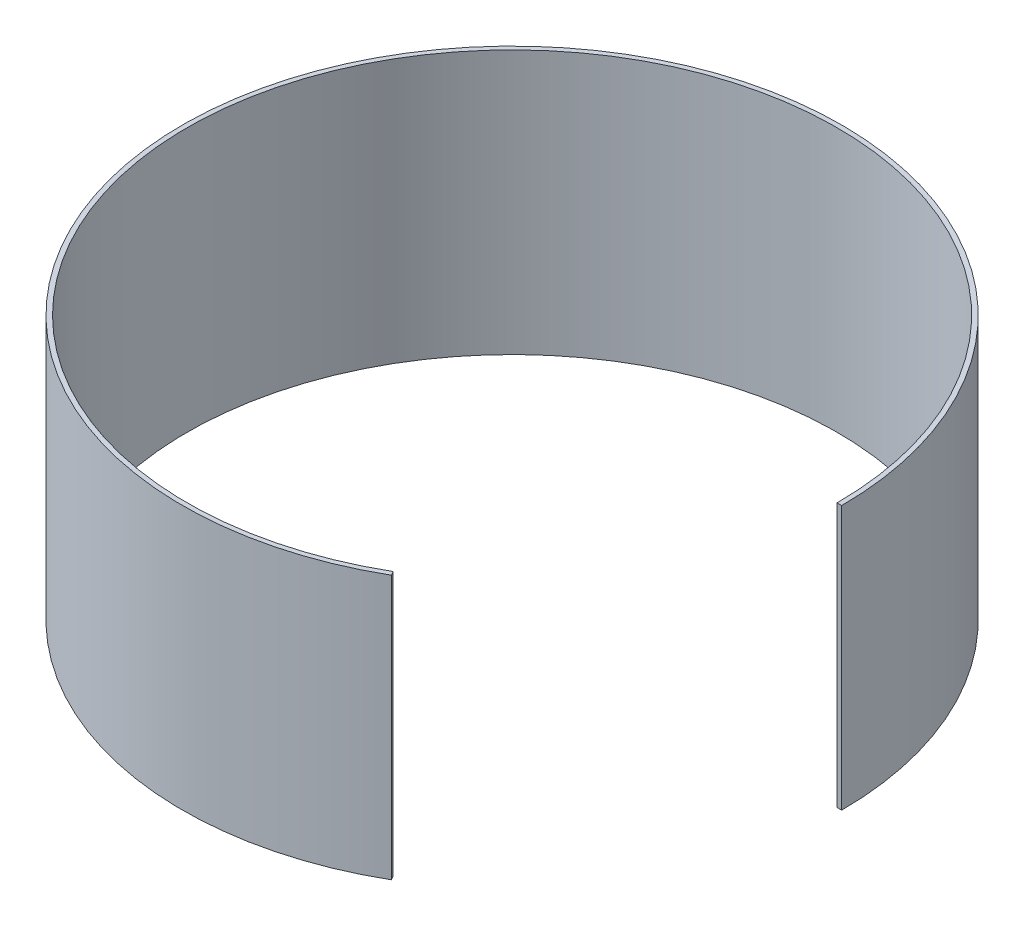
from build123d import *

# Parameters (mm, degrees)
SKETCH1_W      = 6
SKETCH1_H      = 341
REVOLVE1_ANGLE = 300


with BuildPart() as part:
    # Sketch1 → Revolve1 (revolve)
    with BuildSketch(Plane.XY):
        with Locations((423, 170.5)):
            Rectangle(SKETCH1_W, SKETCH1_H)
    revolve(axis=Axis((0, 0, 0), (0, 1, 0)), revolution_arc=REVOLVE1_ANGLE)


solid = part.part
